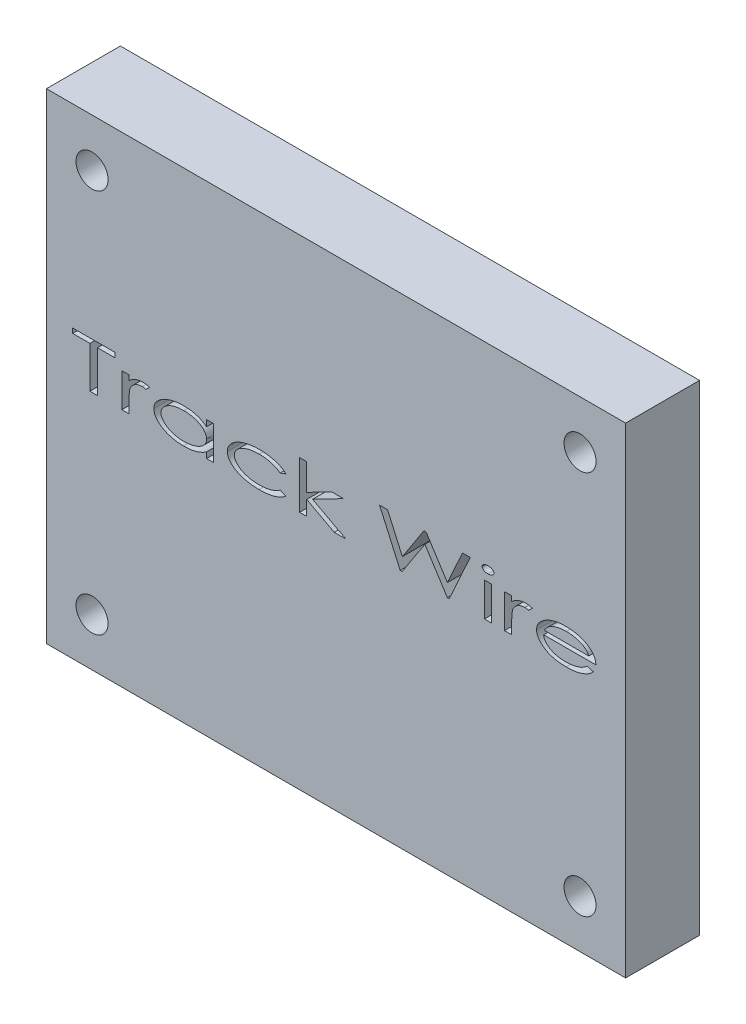
from build123d import *

# Parameters (mm, degrees)
SKETCH1_W           = 59.69
SKETCH1_H           = 49.53
BOSS_EXTRUDE1_DEPTH = 7.62
SKETCH2_W           = 0.732692308
SKETCH2_H           = 3.480288462
CUT_EXTRUDE1_DEPTH  = 116.894596423
SKETCH3_R           = 1.651
CUT_EXTRUDE2_DEPTH  = 116.894596565


with BuildPart() as part:
    # Sketch1 → Boss-Extrude1 (new body)
    with BuildSketch(Plane.XY):
        with Locations((-72.183740645, 29.674224485)):
            Rectangle(SKETCH1_W, SKETCH1_H)
    extrude(amount=BOSS_EXTRUDE1_DEPTH)

    # Sketch2 → Cut-Extrude1 (cut, through all)
    # profile 1 of 10: a face of its own
    with BuildSketch(Plane.XY.offset(7.62)):
        Polygon((-99.323884876, 33.948262947), (-99.323884876, 34.436724485), (-94.988788722, 34.436724485), (-94.988788722, 33.948262947), (-96.759461799, 33.948262947), (-96.759461799, 29.674224485), (-97.553211799, 29.674224485), (-97.553211799, 33.948262947), align=None)
    # profile 2 of 10: a face of its own
    with BuildSketch(Plane.XY.offset(7.62)):
        with BuildLine():
            Line((-94.256096414, 33.154512947), (-93.523404106, 33.154512947))
            Line((-93.523404106, 33.154512947), (-93.523404106, 32.642200747))
            add(Edge.make_bspline(
                [(-93.523404106, 32.642200747), (-93.467694874, 32.690398404), (-93.358318141, 32.785027283), (-93.182098849, 32.905017423), (-93.001514764, 33.004233861), (-92.81639272, 33.083113056), (-92.626752276, 33.141487437), (-92.433986157, 33.185472156), (-92.236759585, 33.210340508), (-92.103878358, 33.21382016), (-92.037030909, 33.215570639)],
                knots=[0, 0, 0, 0, 1.083096568, 2.126497855, 3.129473391, 4.110603161, 5.081358739, 6.045075582, 7.01655251, 8, 8, 8, 8], degree=3))
            add(Edge.make_bspline(
                [(-92.037030909, 33.215570639), (-91.985441927, 33.213959067), (-91.879919938, 33.2106627), (-91.719370391, 33.187643733), (-91.553367106, 33.150605692), (-91.443045921, 33.114738666), (-91.386384876, 33.096317334)],
                knots=[0, 0, 0, 0, 0.931680211, 1.905692724, 2.924362168, 4, 4, 4, 4], degree=3))
            Line((-91.386384876, 33.096317334), (-91.780397796, 32.726155074))
            add(Edge.make_bspline(
                [(-91.780397796, 32.726155074), (-91.817221135, 32.735340067), (-91.887389711, 32.752842495), (-91.988432468, 32.773432157), (-92.080616178, 32.785582423), (-92.139081254, 32.787336036), (-92.166778505, 32.788166793)],
                knots=[0, 0, 0, 0, 1.160725492, 2.21181613, 3.152865595, 4, 4, 4, 4], degree=3))
            add(Edge.make_bspline(
                [(-92.166778505, 32.788166793), (-92.227364151, 32.785989695), (-92.348240521, 32.781646097), (-92.527453837, 32.745603887), (-92.703192403, 32.687856488), (-92.845211612, 32.621772178), (-92.954537248, 32.557625315), (-93.031720258, 32.502275499), (-93.10388289, 32.440407829), (-93.171793459, 32.372998096), (-93.23375583, 32.298340213), (-93.290141281, 32.217208314), (-93.343038692, 32.130992655), (-93.372859421, 32.069422654), (-93.387932351, 32.038302009)],
                knots=[0, 0, 0, 0, 1.437858431, 2.868717621, 4.323240743, 5.823459513, 6.578608968, 7.331034156, 8.075686462, 8.834039471, 9.600882258, 10.376158647, 11.179227086, 12, 12, 12, 12], degree=3))
            add(Edge.make_bspline(
                [(-93.387932351, 32.038302009), (-93.399004046, 32.010829466), (-93.423266849, 31.950625413), (-93.44933198, 31.847630589), (-93.473653844, 31.72645278), (-93.490094693, 31.585978195), (-93.506128338, 31.42735938), (-93.515641006, 31.249728828), (-93.522760754, 31.053169956), (-93.523183175, 30.91573914), (-93.523404106, 30.843860904)],
                knots=[0, 0, 0, 0, 0.587616391, 1.287717961, 2.10513628, 3.041188632, 4.09436528, 5.27103941, 6.572715482, 8, 8, 8, 8], degree=3))
            Line((-93.523404106, 30.843860904), (-93.523404106, 29.674224485))
            Line((-93.523404106, 29.674224485), (-94.256096414, 29.674224485))
            Line((-94.256096414, 29.674224485), (-94.256096414, 33.154512947))
        make_face()
    # profile 3 of 10: a face of its own
    with BuildSketch(Plane.XY.offset(7.62)):
        with BuildLine():
            Line((-84.792154106, 33.154512947), (-84.792154106, 29.674224485))
            Line((-84.792154106, 29.674224485), (-85.524846414, 29.674224485))
            Line((-85.524846414, 29.674224485), (-85.524846414, 30.27621517))
            add(Edge.make_bspline(
                [(-85.524846414, 30.27621517), (-85.606538152, 30.221161995), (-85.770150211, 30.1109016), (-86.03454091, 29.974327083), (-86.312372155, 29.858960908), (-86.605128025, 29.767952361), (-86.912123054, 29.698346471), (-87.232917606, 29.649786539), (-87.567723543, 29.617819487), (-87.79567134, 29.6147373), (-87.911820573, 29.613166793)],
                knots=[0, 0, 0, 0, 0.938276608, 1.879178606, 2.830466252, 3.802542008, 4.797397624, 5.827956145, 6.893249982, 8, 8, 8, 8], degree=3))
            add(Edge.make_bspline(
                [(-87.911820573, 29.613166793), (-88.014905682, 29.614838016), (-88.217880552, 29.618128657), (-88.516380858, 29.64341006), (-88.803461004, 29.684147197), (-89.079286647, 29.741183742), (-89.343567732, 29.815478664), (-89.596381245, 29.906364325), (-89.837786201, 30.013162084), (-90.028531089, 30.116657245), (-90.173014816, 30.205960041), (-90.274294678, 30.274636423), (-90.368530076, 30.34498791), (-90.456211051, 30.417111038), (-90.536829799, 30.490648596), (-90.610129254, 30.567076429), (-90.676655278, 30.644611772), (-90.736102849, 30.724375667), (-90.789143483, 30.805248841), (-90.833240722, 30.888895517), (-90.873941925, 30.972672013), (-90.903121002, 31.060014642), (-90.929195583, 31.148137381), (-90.945563846, 31.238679212), (-90.956669207, 31.330776095), (-90.958206597, 31.392710578), (-90.958981029, 31.423908981)],
                knots=[0, 0, 0, 0, 1.910279983, 3.761346675, 5.547512368, 7.281328381, 8.977359383, 10.630956965, 12.256237844, 13.864891921, 14.64830445, 15.403520314, 16.13197672, 16.826978057, 17.506897155, 18.152971592, 18.788393711, 19.39897725, 19.995664091, 20.578450673, 21.150620836, 21.719136869, 22.282589778, 22.852448378, 23.421941138, 24, 24, 24, 24], degree=3))
            add(Edge.make_bspline(
                [(-90.958981029, 31.423908981), (-90.958202414, 31.454470616), (-90.956656866, 31.515135264), (-90.945614395, 31.605349718), (-90.928941288, 31.694213751), (-90.903623232, 31.781115038), (-90.872402847, 31.866556774), (-90.832596501, 31.949721579), (-90.786952252, 32.031764913), (-90.734323763, 32.112331983), (-90.673966763, 32.190444059), (-90.606640491, 32.266805421), (-90.533657417, 32.342614127), (-90.451679141, 32.414710955), (-90.363756062, 32.486610367), (-90.268839848, 32.557078368), (-90.166000049, 32.62451262), (-90.020850254, 32.714184798), (-89.827881358, 32.816249209), (-89.584699601, 32.923566103), (-89.329919612, 33.014169457), (-89.063444283, 33.087152285), (-88.786421168, 33.145851678), (-88.497634189, 33.186425698), (-88.197482087, 33.210340644), (-87.993592592, 33.213807246), (-87.889877964, 33.215570639)],
                knots=[0, 0, 0, 0, 0.565802482, 1.12311428, 1.680923623, 2.238235421, 2.797193639, 3.363547436, 3.943513815, 4.534760552, 5.143689659, 5.769663481, 6.419287747, 7.09072484, 7.789692423, 8.522257668, 9.27844131, 10.066203143, 11.681083337, 13.315758456, 14.984590301, 16.683274081, 18.428357287, 20.224670812, 22.079563332, 24, 24, 24, 24], degree=3))
            add(Edge.make_bspline(
                [(-87.889877964, 33.215570639), (-87.770877411, 33.213601259), (-87.537850465, 33.209744819), (-87.197273074, 33.178304884), (-86.874163292, 33.124541465), (-86.61686286, 33.063375874), (-86.420044303, 33.003437311), (-86.278403653, 32.951659579), (-86.141260374, 32.893509981), (-86.008492129, 32.829526459), (-85.880209221, 32.759944156), (-85.756967774, 32.683457773), (-85.638408416, 32.600304083), (-85.562728935, 32.540487303), (-85.524846414, 32.510545098)],
                knots=[0, 0, 0, 0, 1.701113661, 3.331121664, 4.884290611, 6.380685909, 7.108376196, 7.824643053, 8.535652809, 9.237194791, 9.930959315, 10.621079341, 11.309760178, 12, 12, 12, 12], degree=3))
            Line((-85.524846414, 32.510545098), (-85.524846414, 33.154512947))
            Line((-85.524846414, 33.154512947), (-84.792154106, 33.154512947))
        make_face()
        with BuildLine():
            add(Edge.make_bspline(
                [(-87.872705489, 32.788166793), (-87.977103751, 32.785980581), (-88.181995966, 32.781689918), (-88.483513075, 32.747483496), (-88.772652488, 32.69172609), (-89.004073092, 32.625965369), (-89.180397072, 32.563895922), (-89.304851306, 32.512145616), (-89.422475762, 32.455974262), (-89.533084224, 32.394729521), (-89.637558264, 32.329943056), (-89.735037712, 32.26048469), (-89.825036441, 32.185623709), (-89.907748687, 32.107025115), (-89.981581763, 32.025321625), (-90.047233459, 31.94292815), (-90.103444142, 31.859289374), (-90.146468634, 31.772648746), (-90.183245628, 31.686515993), (-90.207422441, 31.59822761), (-90.223818678, 31.509110481), (-90.225466054, 31.449104624), (-90.226288722, 31.419138848)],
                knots=[0, 0, 0, 0, 2.104451755, 4.130200756, 6.109440206, 8.035573109, 8.974512805, 9.8770865, 10.751763813, 11.601214125, 12.42493949, 13.229169818, 14.012345307, 14.783299874, 15.527722598, 16.230676602, 16.906436804, 17.554496656, 18.178413533, 18.791395605, 19.396446124, 20, 20, 20, 20], degree=3))
            add(Edge.make_bspline(
                [(-90.226288722, 31.419138848), (-90.225435067, 31.389497846), (-90.223716464, 31.329823745), (-90.207656917, 31.241239909), (-90.18265947, 31.153271807), (-90.147434738, 31.066409765), (-90.100532585, 30.981143331), (-90.045573725, 30.896207346), (-89.979600055, 30.812745026), (-89.905168396, 30.730319733), (-89.820915307, 30.651699032), (-89.73041012, 30.576151356), (-89.63267331, 30.505209826), (-89.527776831, 30.439875407), (-89.416305332, 30.378437527), (-89.297993927, 30.321071275), (-89.172294155, 30.269076114), (-88.995582335, 30.205229618), (-88.765241726, 30.137828996), (-88.478024149, 30.082685406), (-88.18144439, 30.046833523), (-87.980297882, 30.042676111), (-87.878429647, 30.040570639)],
                knots=[0, 0, 0, 0, 0.59795709, 1.203824054, 1.811457398, 2.442159048, 3.091379166, 3.773421124, 4.482371108, 5.23686747, 6.013520422, 6.806793909, 7.615862906, 8.449547882, 9.30014443, 10.184572762, 11.102686208, 12.045060611, 13.977337132, 15.940344752, 17.944036322, 20, 20, 20, 20], degree=3))
            add(Edge.make_bspline(
                [(-87.878429647, 30.040570639), (-87.775307476, 30.042816047), (-87.571063657, 30.047263304), (-87.268916293, 30.081358844), (-86.975102378, 30.137562047), (-86.737690378, 30.203204003), (-86.556170407, 30.267014736), (-86.427460989, 30.317238953), (-86.30745052, 30.372517117), (-86.195423452, 30.431890956), (-86.090815869, 30.494647866), (-85.994972261, 30.562456108), (-85.906162836, 30.632894977), (-85.827253005, 30.708466201), (-85.756409139, 30.786840872), (-85.69370979, 30.867526253), (-85.642567803, 30.952292024), (-85.598723953, 31.037895468), (-85.566444596, 31.126858343), (-85.542263419, 31.217754067), (-85.527585766, 31.311494561), (-85.525762531, 31.374884888), (-85.524846414, 31.406736505)],
                knots=[0, 0, 0, 0, 2.070864307, 4.101554781, 6.098301208, 8.074128826, 9.041717664, 9.962114113, 10.848068781, 11.693809193, 12.507691977, 13.296243265, 14.050363082, 14.782245526, 15.487732309, 16.171190118, 16.830648768, 17.473346079, 18.099810632, 18.727251241, 19.360484379, 20, 20, 20, 20], degree=3))
            add(Edge.make_bspline(
                [(-85.524846414, 31.406736505), (-85.526828517, 31.454927435), (-85.530757476, 31.55045231), (-85.563441358, 31.690644035), (-85.617408958, 31.824371344), (-85.693214048, 31.951624541), (-85.78987848, 32.072463347), (-85.907211073, 32.187285463), (-86.046185878, 32.295304972), (-86.204248807, 32.395960171), (-86.377849818, 32.487321911), (-86.562070958, 32.568968673), (-86.75684064, 32.636666842), (-86.961379691, 32.69141834), (-87.175303162, 32.735967653), (-87.399192232, 32.765313412), (-87.632551085, 32.785633195), (-87.791566929, 32.787310792), (-87.872705489, 32.788166793)],
                knots=[0, 0, 0, 0, 0.772404783, 1.531073807, 2.295603873, 3.077819596, 3.898487165, 4.771526676, 5.70536891, 6.717239184, 7.773903941, 8.849803665, 9.946975293, 11.07813685, 12.244775409, 13.449694693, 14.698695094, 16, 16, 16, 16], degree=3))
        make_face(mode=Mode.SUBTRACT)
    # profile 4 of 10: a face of its own
    with BuildSketch(Plane.XY.offset(7.62)):
        with BuildLine():
            Line((-77.343115645, 32.399878031), (-77.941290224, 32.17758987))
            add(Edge.make_bspline(
                [(-77.941290224, 32.17758987), (-78.009296922, 32.22684601), (-78.14699001, 32.326574863), (-78.37499295, 32.44909454), (-78.619618363, 32.554994873), (-78.882707949, 32.640146024), (-79.163453011, 32.706941106), (-79.462298577, 32.754019432), (-79.779123119, 32.783022414), (-79.996517118, 32.786424146), (-80.107884275, 32.788166793)],
                knots=[0, 0, 0, 0, 0.878629052, 1.778959304, 2.703940385, 3.667686942, 4.67104556, 5.723482898, 6.833779969, 8, 8, 8, 8], degree=3))
            add(Edge.make_bspline(
                [(-80.107884275, 32.788166793), (-80.197269827, 32.786738047), (-80.372727542, 32.783933516), (-80.630156115, 32.766267414), (-80.875583778, 32.73439309), (-81.10966748, 32.692107342), (-81.332094401, 32.635769985), (-81.543014557, 32.567083654), (-81.742824573, 32.487266118), (-81.928017893, 32.3941818), (-82.097149613, 32.293738501), (-82.244869896, 32.185531043), (-82.371499593, 32.073219946), (-82.474598665, 31.954316604), (-82.55572011, 31.830114931), (-82.612406185, 31.699474671), (-82.648689854, 31.563556679), (-82.652981787, 31.47056109), (-82.655134876, 31.423908981)],
                knots=[0, 0, 0, 0, 1.360064782, 2.669713992, 3.923440371, 5.123965893, 6.286939203, 7.411585485, 8.496983143, 9.557285293, 10.562186567, 11.486407369, 12.339495697, 13.131975914, 13.874190573, 14.587057495, 15.291184146, 16, 16, 16, 16], degree=3))
            add(Edge.make_bspline(
                [(-82.655134876, 31.423908981), (-82.654394634, 31.393296483), (-82.652911233, 31.331950814), (-82.635239199, 31.240980024), (-82.610256838, 31.151096546), (-82.572756386, 31.063205997), (-82.526261159, 30.976372667), (-82.468190009, 30.891151932), (-82.400380147, 30.807107198), (-82.322022763, 30.72529778), (-82.234713014, 30.646871924), (-82.139532068, 30.571832332), (-82.036564889, 30.501439668), (-81.925625882, 30.435579065), (-81.80704343, 30.374596499), (-81.680684342, 30.317997949), (-81.546190579, 30.267341443), (-81.405273709, 30.218964236), (-81.257801772, 30.178096315), (-81.106040173, 30.139925119), (-80.949125646, 30.110331983), (-80.788313197, 30.083834217), (-80.622653991, 30.065510728), (-80.453133771, 30.05091941), (-80.279064845, 30.042182768), (-80.161637367, 30.041112654), (-80.102160116, 30.040570639)],
                knots=[0, 0, 0, 0, 0.694098705, 1.390933559, 2.097095384, 2.809138929, 3.555395272, 4.330404435, 5.146821577, 6.004805395, 6.899466122, 7.809495386, 8.754789944, 9.729331085, 10.736882063, 11.780849217, 12.871035211, 13.998991466, 15.16237378, 16.344449645, 17.55092778, 18.786651646, 20.044101846, 21.333889887, 22.649609931, 24, 24, 24, 24], degree=3))
            add(Edge.make_bspline(
                [(-80.102160116, 30.040570639), (-79.994288716, 30.042316143), (-79.783239706, 30.045731199), (-79.47437788, 30.074943728), (-79.180661831, 30.122085161), (-78.902138178, 30.188775368), (-78.638673649, 30.274433211), (-78.390593636, 30.38013748), (-78.156247262, 30.502800381), (-78.012559448, 30.601962904), (-77.941290224, 30.651147562)],
                knots=[0, 0, 0, 0, 1.133712812, 2.218094579, 3.257865643, 4.258377957, 5.225635361, 6.166278682, 7.090473355, 8, 8, 8, 8], degree=3))
            Line((-77.941290224, 30.651147562), (-77.343115645, 30.416457057))
            add(Edge.make_bspline(
                [(-77.343115645, 30.416457057), (-77.379594208, 30.385100615), (-77.453709547, 30.321392146), (-77.574388494, 30.233932185), (-77.7042059, 30.151944387), (-77.843123961, 30.075883308), (-77.990434225, 30.003578178), (-78.147966945, 29.938649699), (-78.313900078, 29.877256458), (-78.48848756, 29.822332334), (-78.670443847, 29.77264533), (-78.859544546, 29.72983725), (-79.054979221, 29.693727931), (-79.256425809, 29.664246077), (-79.4638942, 29.641238742), (-79.677757563, 29.625628608), (-79.897875535, 29.614226375), (-80.046811267, 29.61352287), (-80.122194671, 29.613166793)],
                knots=[0, 0, 0, 0, 0.781644841, 1.58810729, 2.41988382, 3.275929976, 4.161374423, 5.085867854, 6.044222526, 7.036562044, 8.059816839, 9.109420323, 10.187159544, 11.289570803, 12.418128226, 13.579360244, 14.774799967, 16, 16, 16, 16], degree=3))
            add(Edge.make_bspline(
                [(-80.122194671, 29.613166793), (-80.237046958, 29.614389278), (-80.462262538, 29.616786466), (-80.792422177, 29.642717642), (-81.107854588, 29.681879091), (-81.408057218, 29.738031733), (-81.693332319, 29.810495897), (-81.963841201, 29.898952617), (-82.219379397, 30.003958046), (-82.420308053, 30.105270566), (-82.570821601, 30.193424974), (-82.676268857, 30.260399416), (-82.774917209, 30.328688521), (-82.865223921, 30.400324339), (-82.948376814, 30.473170771), (-83.025629513, 30.546282548), (-83.093779237, 30.623047458), (-83.156382543, 30.700137655), (-83.211385415, 30.779644737), (-83.257252385, 30.861689238), (-83.298620213, 30.94420843), (-83.330541869, 31.029480492), (-83.356612561, 31.116074312), (-83.374827605, 31.204493837), (-83.38541708, 31.294537277), (-83.387019777, 31.355191527), (-83.387827183, 31.385747923)],
                knots=[0, 0, 0, 0, 2.035361596, 3.991171202, 5.866299302, 7.667208056, 9.400722302, 11.079845565, 12.707574722, 14.293191904, 15.063694863, 15.798635432, 16.507005297, 17.189260055, 17.840419057, 18.46629994, 19.072976247, 19.658383324, 20.225933031, 20.783856094, 21.323336278, 21.860366749, 22.395411559, 22.92493491, 23.458403738, 24, 24, 24, 24], degree=3))
            add(Edge.make_bspline(
                [(-83.387827183, 31.385747923), (-83.386533103, 31.426848159), (-83.383949605, 31.508900611), (-83.363299242, 31.630949938), (-83.328736216, 31.750512501), (-83.280451602, 31.867746645), (-83.218886199, 31.982652469), (-83.144199116, 32.095414331), (-83.055632273, 32.205774288), (-82.953559504, 32.312615497), (-82.840723099, 32.416699953), (-82.715652155, 32.513501661), (-82.582313631, 32.606746198), (-82.437476967, 32.692352812), (-82.282860782, 32.772294876), (-82.11826673, 32.846907047), (-81.943625865, 32.915238876), (-81.7597124, 32.978182976), (-81.567733332, 33.034122192), (-81.369098129, 33.082745226), (-81.165055328, 33.123707499), (-80.955252189, 33.156809157), (-80.740252042, 33.184059354), (-80.518967946, 33.201350797), (-80.292465347, 33.213511849), (-80.13938395, 33.214879894), (-80.062091005, 33.215570639)],
                knots=[0, 0, 0, 0, 0.712709121, 1.422851454, 2.140475795, 2.867851858, 3.618131318, 4.398475124, 5.210938724, 6.069464395, 6.959733527, 7.87131877, 8.810935039, 9.780708768, 10.787423132, 11.829317109, 12.914213039, 14.039483482, 15.200430694, 16.381906539, 17.586090433, 18.809593046, 20.065913425, 21.344588603, 22.659245533, 24, 24, 24, 24], degree=3))
            add(Edge.make_bspline(
                [(-80.062091005, 33.215570639), (-79.964741773, 33.214338362), (-79.77142632, 33.211891315), (-79.484027925, 33.190725113), (-79.201429085, 33.159366676), (-78.926889304, 33.112236741), (-78.66526645, 33.055771945), (-78.421343425, 32.99160913), (-78.198674705, 32.918225068), (-77.995329735, 32.837046787), (-77.80942716, 32.745957487), (-77.638778667, 32.643982748), (-77.482795302, 32.529202948), (-77.389419418, 32.44274921), (-77.343115645, 32.399878031)],
                knots=[0, 0, 0, 0, 1.207103106, 2.397057267, 3.572082896, 4.731981167, 5.849733325, 6.890532118, 7.858302887, 8.755417083, 9.603772541, 10.422829623, 11.217903635, 12, 12, 12, 12], degree=3))
        make_face()
    # profile 5 of 10: a face of its own
    with BuildSketch(Plane.XY.offset(7.62)):
        Polygon((-75.938788722, 34.55883987), (-75.206096414, 34.55883987), (-75.206096414, 31.819829954), (-72.631179046, 33.154512947), (-71.420519491, 33.154512947), (-74.60124365, 31.505955255), (-71.176288722, 29.674224485), (-72.365959695, 29.674224485), (-75.206096414, 31.193034582), (-75.206096414, 29.674224485), (-75.938788722, 29.674224485), align=None)
    # profile 6 of 10: a face of its own
    with BuildSketch(Plane.XY.offset(7.62)):
        Polygon((-67.69600026, 34.436724485), (-66.871721414, 34.436724485), (-65.345279106, 31.017493716), (-63.119535416, 34.436724485), (-62.901063361, 34.436724485), (-60.704894491, 31.017493716), (-59.152693469, 34.436724485), (-58.354173337, 34.436724485), (-60.515997255, 29.674224485), (-60.71061865, 29.674224485), (-63.025086799, 33.276628332), (-65.370083794, 29.674224485), (-65.56947532, 29.674224485), align=None)
    # profile 7 of 10: a face of its own
    with BuildSketch(Plane.XY.offset(7.62)):
        with BuildLine():
            add(Edge.make_bspline(
                [(-56.525304647, 34.619897562), (-56.484524786, 34.618654394), (-56.40530403, 34.61623936), (-56.291101047, 34.596505354), (-56.186699383, 34.561426892), (-56.093398232, 34.515615979), (-56.013866444, 34.461264134), (-55.955691926, 34.39745393), (-55.918627716, 34.326708529), (-55.914107885, 34.276534272), (-55.911865645, 34.251643356)],
                knots=[0, 0, 0, 0, 1.249454596, 2.427245573, 3.536840729, 4.613498208, 5.606046004, 6.468899324, 7.240437191, 8, 8, 8, 8], degree=3))
            add(Edge.make_bspline(
                [(-55.911865645, 34.251643356), (-55.914154435, 34.227395501), (-55.918801579, 34.178162834), (-55.955735164, 34.108614169), (-56.014213501, 34.045854301), (-56.093351389, 33.991440231), (-56.186712772, 33.945689246), (-56.29109719, 33.910593625), (-56.405305088, 33.89086451), (-56.484525146, 33.888448781), (-56.525304647, 33.887205255)],
                knots=[0, 0, 0, 0, 0.743582069, 1.509763612, 2.369159244, 3.366096939, 4.447516322, 5.562019061, 6.745019242, 8, 8, 8, 8], degree=3))
            add(Edge.make_bspline(
                [(-56.525304647, 33.887205255), (-56.565457509, 33.888406557), (-56.643119529, 33.890730067), (-56.755625789, 33.911002193), (-56.859091644, 33.945713815), (-56.952393081, 33.991137433), (-57.030758744, 34.046171585), (-57.089169929, 34.108586213), (-57.126078972, 34.178169256), (-57.130729187, 34.22739762), (-57.133019491, 34.251643356)],
                knots=[0, 0, 0, 0, 1.24420612, 2.406492481, 3.528911749, 4.618012665, 5.614012158, 6.479512243, 7.251136123, 8, 8, 8, 8], degree=3))
            add(Edge.make_bspline(
                [(-57.133019491, 34.251643356), (-57.130775687, 34.276532078), (-57.126252705, 34.326701913), (-57.089213366, 34.397482212), (-57.031103507, 34.460944215), (-56.952346248, 34.515918731), (-56.859105083, 34.56140239), (-56.755622024, 34.596096873), (-56.643120563, 34.61637378), (-56.565457861, 34.618696611), (-56.525304647, 34.619897562)],
                knots=[0, 0, 0, 0, 0.764934205, 1.541928153, 2.410883309, 3.402466019, 4.486737291, 5.604179166, 6.761311341, 8, 8, 8, 8], degree=3))
        make_face()
    # profile 8 of 10: a face of its own
    with BuildSketch(Plane.XY.offset(7.62)):
        with Locations((-56.522442568, 31.414368716)):
            Rectangle(SKETCH2_W, SKETCH2_H)
    # profile 9 of 10: a face of its own
    with BuildSketch(Plane.XY.offset(7.62)):
        with BuildLine():
            Line((-54.812827183, 33.154512947), (-54.080134876, 33.154512947))
            Line((-54.080134876, 33.154512947), (-54.080134876, 32.642200747))
            add(Edge.make_bspline(
                [(-54.080134876, 32.642200747), (-54.024425643, 32.690398404), (-53.915048911, 32.785027283), (-53.738829618, 32.905017423), (-53.558245533, 33.004233861), (-53.373123489, 33.083113056), (-53.183483045, 33.141487437), (-52.990716926, 33.185472156), (-52.793490354, 33.210340508), (-52.660609127, 33.21382016), (-52.593761678, 33.215570639)],
                knots=[0, 0, 0, 0, 1.083096568, 2.126497855, 3.129473391, 4.110603161, 5.081358739, 6.045075582, 7.01655251, 8, 8, 8, 8], degree=3))
            add(Edge.make_bspline(
                [(-52.593761678, 33.215570639), (-52.542172696, 33.213959067), (-52.436650707, 33.2106627), (-52.276101161, 33.187643733), (-52.110097875, 33.150605692), (-51.99977669, 33.114738666), (-51.943115645, 33.096317334)],
                knots=[0, 0, 0, 0, 0.931680211, 1.905692724, 2.924362168, 4, 4, 4, 4], degree=3))
            Line((-51.943115645, 33.096317334), (-52.337128565, 32.726155074))
            add(Edge.make_bspline(
                [(-52.337128565, 32.726155074), (-52.373951904, 32.735340067), (-52.444120481, 32.752842495), (-52.545163237, 32.773432157), (-52.637346947, 32.785582423), (-52.695812023, 32.787336036), (-52.723509275, 32.788166793)],
                knots=[0, 0, 0, 0, 1.160725492, 2.21181613, 3.152865595, 4, 4, 4, 4], degree=3))
            add(Edge.make_bspline(
                [(-52.723509275, 32.788166793), (-52.78409492, 32.785989695), (-52.90497129, 32.781646097), (-53.084184606, 32.745603887), (-53.259923173, 32.687856488), (-53.401942381, 32.621772178), (-53.511268017, 32.557625315), (-53.588451027, 32.502275499), (-53.66061366, 32.440407829), (-53.728524228, 32.372998096), (-53.7904866, 32.298340213), (-53.84687205, 32.217208314), (-53.899769461, 32.130992655), (-53.929590191, 32.069422654), (-53.944663121, 32.038302009)],
                knots=[0, 0, 0, 0, 1.437858431, 2.868717621, 4.323240743, 5.823459513, 6.578608968, 7.331034156, 8.075686462, 8.834039471, 9.600882258, 10.376158647, 11.179227086, 12, 12, 12, 12], degree=3))
            add(Edge.make_bspline(
                [(-53.944663121, 32.038302009), (-53.955734816, 32.010829466), (-53.979997618, 31.950625413), (-54.006062749, 31.847630589), (-54.030384613, 31.72645278), (-54.046825462, 31.585978195), (-54.062859107, 31.42735938), (-54.072371775, 31.249728828), (-54.079491523, 31.053169956), (-54.079913944, 30.91573914), (-54.080134876, 30.843860904)],
                knots=[0, 0, 0, 0, 0.587616391, 1.287717961, 2.10513628, 3.041188632, 4.09436528, 5.27103941, 6.572715482, 8, 8, 8, 8], degree=3))
            Line((-54.080134876, 30.843860904), (-54.080134876, 29.674224485))
            Line((-54.080134876, 29.674224485), (-54.812827183, 29.674224485))
            Line((-54.812827183, 29.674224485), (-54.812827183, 33.154512947))
        make_face()
    # profile 10 of 10: a face of its own
    with BuildSketch(Plane.XY.offset(7.62)):
        with BuildLine():
            Line((-46.290508974, 30.773262947), (-45.654173337, 30.57387142))
            add(Edge.make_bspline(
                [(-45.654173337, 30.57387142), (-45.707236783, 30.51968819), (-45.81298859, 30.41170473), (-45.989445989, 30.268963427), (-46.176340616, 30.140081373), (-46.377404725, 30.029574193), (-46.590164614, 29.933235786), (-46.815357738, 29.849313325), (-47.053007031, 29.776933026), (-47.30395303, 29.716588079), (-47.569675785, 29.669905063), (-47.85157429, 29.637068528), (-48.150560028, 29.616731985), (-48.355624615, 29.614376344), (-48.46091913, 29.613166793)],
                knots=[0, 0, 0, 0, 0.893872651, 1.781426873, 2.672011637, 3.568618907, 4.483463387, 5.424717609, 6.401245631, 7.412011874, 8.467161676, 9.581458509, 10.758151469, 12, 12, 12, 12], degree=3))
            add(Edge.make_bspline(
                [(-48.46091913, 29.613166793), (-48.577360836, 29.614715613), (-48.803865509, 29.617728408), (-49.133885753, 29.64390494), (-49.444620922, 29.686211046), (-49.73612123, 29.745871072), (-50.008069796, 29.822781808), (-50.260294855, 29.917328652), (-50.493435262, 30.028816193), (-50.704974947, 30.157348045), (-50.894120308, 30.295873192), (-51.059460644, 30.440231089), (-51.200217865, 30.589026187), (-51.314632011, 30.743549392), (-51.405047563, 30.901708156), (-51.468705676, 31.065263559), (-51.508821053, 31.233391446), (-51.513415062, 31.347687218), (-51.515711799, 31.404828452)],
                knots=[0, 0, 0, 0, 1.436500919, 2.794309575, 4.081671249, 5.303656583, 6.462418278, 7.565035135, 8.623250922, 9.646075303, 10.614493212, 11.512536007, 12.350882328, 13.13642223, 13.879584172, 14.591459075, 15.295811512, 16, 16, 16, 16], degree=3))
            add(Edge.make_bspline(
                [(-51.515711799, 31.404828452), (-51.513771641, 31.4584152), (-51.509901378, 31.565311017), (-51.47613233, 31.723074728), (-51.420892687, 31.876071999), (-51.344995886, 32.025054968), (-51.246452765, 32.168611175), (-51.126746307, 32.307550746), (-50.986190793, 32.44283852), (-50.879906342, 32.524594898), (-50.824996654, 32.566832658)],
                knots=[0, 0, 0, 0, 0.914806648, 1.824872872, 2.742660009, 3.687957696, 4.673591136, 5.710278341, 6.817062154, 8, 8, 8, 8], degree=3))
            add(Edge.make_bspline(
                [(-50.824996654, 32.566832658), (-50.74993472, 32.618885095), (-50.598010591, 32.724238377), (-50.349476466, 32.856565165), (-50.082006938, 32.966317766), (-49.797480248, 33.058939417), (-49.493652678, 33.128294634), (-49.171904161, 33.180275709), (-48.831297204, 33.209274292), (-48.598351188, 33.213438103), (-48.479045633, 33.215570639)],
                knots=[0, 0, 0, 0, 0.885087469, 1.791402565, 2.723037079, 3.685430228, 4.689117778, 5.741448666, 6.843261085, 8, 8, 8, 8], degree=3))
            add(Edge.make_bspline(
                [(-48.479045633, 33.215570639), (-48.416709053, 33.214946187), (-48.293579973, 33.213712749), (-48.111570094, 33.206182357), (-47.934325482, 33.192891487), (-47.761938095, 33.173570084), (-47.593816772, 33.150164425), (-47.430971744, 33.12038454), (-47.272725425, 33.086116138), (-47.119240851, 33.046234967), (-46.970458997, 33.000174941), (-46.826049399, 32.949887438), (-46.686594955, 32.893537604), (-46.552342545, 32.831579866), (-46.422704899, 32.764514759), (-46.298116315, 32.69193018), (-46.177207696, 32.615052196), (-46.10066881, 32.558689406), (-46.062496654, 32.530579654)],
                knots=[0, 0, 0, 0, 1.170302022, 2.311615643, 3.419266171, 4.506454613, 5.567762594, 6.605312198, 7.61357418, 8.606949306, 9.581396092, 10.536819344, 11.476955139, 12.403899343, 13.311786533, 14.215975752, 15.110255532, 16, 16, 16, 16], degree=3))
            add(Edge.make_bspline(
                [(-46.062496654, 32.530579654), (-46.011384745, 32.489917016), (-45.911847491, 32.410729068), (-45.780015969, 32.277651769), (-45.667876811, 32.137329066), (-45.575160105, 31.989334778), (-45.50283039, 31.83359489), (-45.451558505, 31.669976192), (-45.417748486, 31.499043012), (-45.412569125, 31.382090922), (-45.409942568, 31.322782178)],
                knots=[0, 0, 0, 0, 1.099316502, 2.140850277, 3.147151128, 4.119141233, 5.075315405, 6.03069416, 7.001325623, 8, 8, 8, 8], degree=3))
            Line((-45.409942568, 31.322782178), (-50.783019491, 31.322782178))
            add(Edge.make_bspline(
                [(-50.783019491, 31.322782178), (-50.779320231, 31.276778992), (-50.771979614, 31.185492673), (-50.736464709, 31.052679613), (-50.682547365, 30.926416626), (-50.609146546, 30.806653049), (-50.514956933, 30.695073506), (-50.403621701, 30.588081168), (-50.271447111, 30.489422916), (-50.122859881, 30.396620302), (-49.959293835, 30.313791405), (-49.785421742, 30.239973469), (-49.601663753, 30.17806269), (-49.408756491, 30.127734289), (-49.206727897, 30.088502499), (-48.995430494, 30.061521414), (-48.774783604, 30.043614906), (-48.624412108, 30.041598721), (-48.547735537, 30.040570639)],
                knots=[0, 0, 0, 0, 0.783697782, 1.555128953, 2.325744266, 3.112423031, 3.934493216, 4.802929368, 5.733303219, 6.734388362, 7.779443175, 8.848372298, 9.944811348, 11.074424368, 12.237082669, 13.442732651, 14.696012877, 16, 16, 16, 16], degree=3))
            add(Edge.make_bspline(
                [(-48.547735537, 30.040570639), (-48.472978592, 30.041423547), (-48.323943191, 30.043123904), (-48.102014036, 30.058774946), (-47.883050083, 30.084694555), (-47.669436772, 30.119610644), (-47.465143688, 30.162466142), (-47.274997244, 30.214471961), (-47.10028781, 30.270740524), (-46.937919892, 30.336218875), (-46.780308795, 30.415662036), (-46.622070694, 30.516173073), (-46.455552955, 30.634564412), (-46.34711069, 30.725696383), (-46.290508974, 30.773262947)],
                knots=[0, 0, 0, 0, 1.10733755, 2.207587504, 3.293881093, 4.372743178, 5.413140364, 6.384533863, 7.291803649, 8.130760059, 8.975608211, 9.902432532, 10.905169332, 12, 12, 12, 12], degree=3))
        make_face()
        with BuildLine():
            add(Edge.make_bspline(
                [(-46.142634876, 31.750186024), (-46.170318049, 31.807372819), (-46.224797818, 31.919914949), (-46.332710289, 32.071326459), (-46.456499203, 32.206232747), (-46.601977996, 32.321803645), (-46.767661852, 32.423559256), (-46.956107731, 32.514079292), (-47.168635457, 32.593596422), (-47.402238486, 32.661663153), (-47.650462947, 32.719189049), (-47.90886544, 32.758114758), (-48.173210669, 32.784425113), (-48.35177685, 32.786912336), (-48.441838601, 32.788166793)],
                knots=[0, 0, 0, 0, 0.857438976, 1.68741769, 2.502538158, 3.324868577, 4.189645395, 5.125862987, 6.146116977, 7.253202234, 8.412708456, 9.587215178, 10.783086326, 12, 12, 12, 12], degree=3))
            add(Edge.make_bspline(
                [(-48.441838601, 32.788166793), (-48.515641323, 32.787336905), (-48.660866808, 32.78570389), (-48.874585588, 32.770275586), (-49.080490957, 32.744117711), (-49.27898013, 32.709939515), (-49.468747443, 32.662265596), (-49.65142508, 32.607422849), (-49.825842347, 32.541034311), (-49.937125134, 32.4880698), (-49.99213157, 32.46188975)],
                knots=[0, 0, 0, 0, 1.107907705, 2.180088089, 3.214637075, 4.223292435, 5.201767465, 6.150219369, 7.08566416, 8, 8, 8, 8], degree=3))
            add(Edge.make_bspline(
                [(-49.99213157, 32.46188975), (-50.030651985, 32.441520278), (-50.107164453, 32.40106073), (-50.214649714, 32.329977234), (-50.315545896, 32.252686122), (-50.408779035, 32.16713644), (-50.494299742, 32.073413474), (-50.573620122, 31.973187655), (-50.646331512, 31.865851392), (-50.687036617, 31.789070907), (-50.707651402, 31.750186024)],
                knots=[0, 0, 0, 0, 1.017964425, 2.021966066, 3.007668941, 3.986171059, 4.97517538, 5.970028059, 6.971936421, 8, 8, 8, 8], degree=3))
            Line((-50.707651402, 31.750186024), (-46.142634876, 31.750186024))
        make_face(mode=Mode.SUBTRACT)
    extrude(amount=-CUT_EXTRUDE1_DEPTH, mode=Mode.SUBTRACT)


with BuildPart() as cut_extrude1_piece_1:
    # of the separate pieces the step leaves, piece 1, a body of its own (cut_extrude1_pieces)
    add(part.part.solids().sort_by_distance((-102.028740645, 54.439224485, 0))[0])

    # Sketch3 → Cut-Extrude2 (cut, through all)
    with BuildSketch(Plane.XY.offset(7.62)):
        with Locations((-97.329740645, 49.486224485)):
            Circle(SKETCH3_R)
        with Locations(Location((-47.037740645, 49.486224485, 0), (0, 0, 180))):
            Circle(SKETCH3_R)
        with Locations((-47.037740645, 9.862224485)):
            Circle(SKETCH3_R)
        with Locations(Location((-97.329740645, 9.862224485, 0), (0, 0, 180))):
            Circle(SKETCH3_R)
    extrude(amount=-CUT_EXTRUDE2_DEPTH, mode=Mode.SUBTRACT)


with BuildPart() as cut_extrude1_piece_2:
    # of the separate pieces the step leaves, piece 2, a body of its own (cut_extrude1_pieces)
    add(part.part.solids().sort_by_distance((-87.878429647, 30.040570639, 0))[0])


with BuildPart() as cut_extrude1_piece_3:
    # of the separate pieces the step leaves, piece 3, a body of its own (cut_extrude1_pieces)
    add(part.part.solids().sort_by_distance((-49.99213157, 32.46188975, 0))[0])


solid = Compound([cut_extrude1_piece_1.part, cut_extrude1_piece_2.part, cut_extrude1_piece_3.part])
